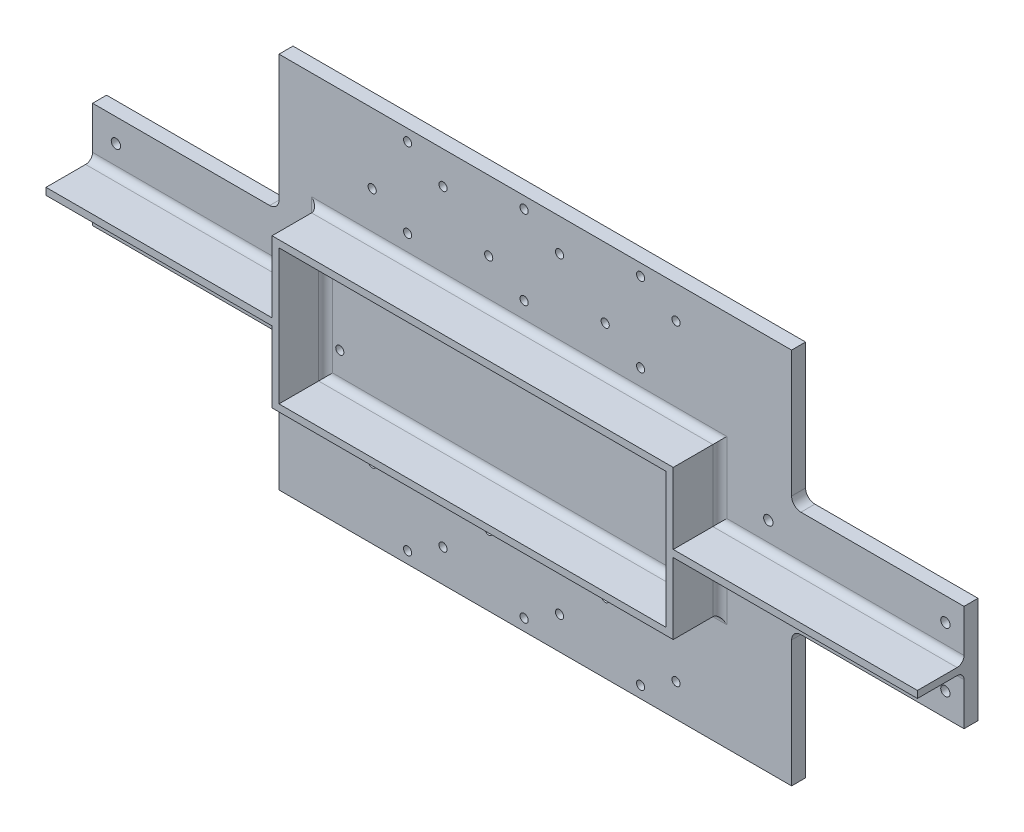
from build123d import *

# Parameters (mm, degrees)
BOSS_EXTRUDE1_DEPTH = 3
SKETCH3_W           = 166.2
SKETCH3_H           = 58
BOSS_EXTRUDE2_DEPTH = 20
SKETCH4_R           = 1.75
CUT_EXTRUDE1_DEPTH  = 205.768161588
FILLET1_R           = 4
FILLET2_R           = 3
CUT_EXTRUDE2_REACH  = 207.441
SKETCH5_R           = 2
SKETCH6_R           = 1.75
CUT_EXTRUDE3_DEPTH  = 205.768161588
SKETCH8_R           = 1.75
CUT_EXTRUDE5_DEPTH  = 205.768161588


with BuildPart() as part:
    # Sketch2 → Boss-Extrude1 (new, symmetric)
    with BuildSketch(Plane.XY):
        Polygon((-187, 22.75), (-187, -22.75), (-107, -22.75), (-107, -81), (113, -81), (113, -22.75), (187, -22.75), (187, 22.75), (113, 22.75), (113, 81), (-107, 81), (-107, 22.75), align=None)
    extrude(amount=BOSS_EXTRUDE1_DEPTH, both=True)

    # Sketch3 → Boss-Extrude2 (add)
    with BuildSketch(Plane.XY.offset(3)):
        Polygon((-187, -1.5), (-90, -1.5), (-90, -32), (82.2, -32), (82.2, -1.5), (187, -1.5), (187, 1.5), (82.2, 1.5), (82.2, 32), (-90, 32), (-90, 1.5), (-187, 1.5), align=None)
        with Locations((-3.9, 0)):
            Rectangle(SKETCH3_W, SKETCH3_H, mode=Mode.SUBTRACT)
    extrude(amount=BOSS_EXTRUDE2_DEPTH)

    # Sketch4 → Cut-Extrude1 (cut, through all)
    with BuildSketch(Plane.XY.offset(3)):
        with Locations((-36.6, -67)):
            Circle(SKETCH4_R)
        with Locations((-67, -51)):
            Circle(SKETCH4_R)
        with Locations((13.4, -67)):
            Circle(SKETCH4_R)
        with Locations((-17, -51)):
            Circle(SKETCH4_R)
        with Locations((63.4, -67)):
            Circle(SKETCH4_R)
        with Locations((33, -51)):
            Circle(SKETCH4_R)
        with Locations(Location((33, 51, 0), (0, 0, 180))):
            Circle(SKETCH4_R)
        with Locations(Location((63.4, 67, 0), (0, 0, 180))):
            Circle(SKETCH4_R)
        with Locations(Location((-17, 51, 0), (0, 0, 180))):
            Circle(SKETCH4_R)
        with Locations(Location((13.4, 67, 0), (0, 0, 180))):
            Circle(SKETCH4_R)
        with Locations(Location((-67, 51, 0), (0, 0, 180))):
            Circle(SKETCH4_R)
        with Locations(Location((-36.6, 67, 0), (0, 0, 180))):
            Circle(SKETCH4_R)
    extrude(amount=-CUT_EXTRUDE1_DEPTH, mode=Mode.SUBTRACT)

    # Fillet1
    fillet1_edges = [part.edges().sort_by_distance(p)[0] for p in [
        (-107, -22.75, 0),
        (-107, 22.75, 0),
        (113, 22.75, 0),
        (113, -22.75, 0),
    ]]
    fillet(fillet1_edges, radius=FILLET1_R)

    # Fillet2
    fillet2_edges = [part.edges().sort_by_distance(p)[0] for p in [
        (-87, 0, 3),
        (-3.9, -29, 3),
        (79.2, 0, 3),
        (-3.9, 29, 3),
        (-138.5, -1.5, 3),
        (-90, -16.75, 3),
        (-3.9, -32, 3),
        (82.2, -16.75, 3),
        (134.6, -1.5, 3),
        (134.6, 1.5, 3),
        (82.2, 16.75, 3),
        (-3.9, 32, 3),
        (-90, 16.75, 3),
        (-138.5, 1.5, 3),
    ]]
    fillet(fillet2_edges, radius=FILLET2_R)

    # Sketch5 → Cut-Extrude2 (cut, up to next)
    with BuildSketch(Plane(origin=(0, 0, -3), x_dir=(-1, 0, 0), z_dir=(0, 0, -1)), mode=Mode.PRIVATE) as cut_extrude2_sk1:
        with Locations((-103, -12.75)):
            Circle(SKETCH5_R)
    cut_extrude2_tool1 = extrude(cut_extrude2_sk1.sketch, amount=-CUT_EXTRUDE2_REACH, mode=Mode.PRIVATE) & part.part
    # Sketch5 → Cut-Extrude2 (cut, up to next)
    with BuildSketch(Plane(origin=(0, 0, -3), x_dir=(-1, 0, 0), z_dir=(0, 0, -1)), mode=Mode.PRIVATE) as cut_extrude2_sk2:
        with Locations((-103, 12.75)):
            Circle(SKETCH5_R)
    cut_extrude2_tool2 = extrude(cut_extrude2_sk2.sketch, amount=-CUT_EXTRUDE2_REACH, mode=Mode.PRIVATE) & part.part
    # Sketch5 → Cut-Extrude2 (cut, up to next)
    with BuildSketch(Plane(origin=(0, 0, -3), x_dir=(-1, 0, 0), z_dir=(0, 0, -1)), mode=Mode.PRIVATE) as cut_extrude2_sk3:
        with Locations((-179, 12.75)):
            Circle(SKETCH5_R)
    cut_extrude2_tool3 = extrude(cut_extrude2_sk3.sketch, amount=-CUT_EXTRUDE2_REACH, mode=Mode.PRIVATE) & part.part
    # Sketch5 → Cut-Extrude2 (cut, up to next)
    with BuildSketch(Plane(origin=(0, 0, -3), x_dir=(-1, 0, 0), z_dir=(0, 0, -1)), mode=Mode.PRIVATE) as cut_extrude2_sk4:
        with Locations((-179, -12.75)):
            Circle(SKETCH5_R)
    cut_extrude2_tool4 = extrude(cut_extrude2_sk4.sketch, amount=-CUT_EXTRUDE2_REACH, mode=Mode.PRIVATE) & part.part
    # Sketch5 → Cut-Extrude2 (cut, up to next)
    with BuildSketch(Plane(origin=(0, 0, -3), x_dir=(-1, 0, 0), z_dir=(0, 0, -1)), mode=Mode.PRIVATE) as cut_extrude2_sk5:
        with Locations((177, 12.75)):
            Circle(SKETCH5_R)
    cut_extrude2_tool5 = extrude(cut_extrude2_sk5.sketch, amount=-CUT_EXTRUDE2_REACH, mode=Mode.PRIVATE) & part.part
    # Sketch5 → Cut-Extrude2 (cut, up to next)
    with BuildSketch(Plane(origin=(0, 0, -3), x_dir=(-1, 0, 0), z_dir=(0, 0, -1)), mode=Mode.PRIVATE) as cut_extrude2_sk6:
        with Locations((177, -12.75)):
            Circle(SKETCH5_R)
    cut_extrude2_tool6 = extrude(cut_extrude2_sk6.sketch, amount=-CUT_EXTRUDE2_REACH, mode=Mode.PRIVATE) & part.part
    # Sketch5 → Cut-Extrude2 (cut, up to next)
    with BuildSketch(Plane(origin=(0, 0, -3), x_dir=(-1, 0, 0), z_dir=(0, 0, -1)), mode=Mode.PRIVATE) as cut_extrude2_sk7:
        with Locations((101, -12.75)):
            Circle(SKETCH5_R)
    cut_extrude2_tool7 = extrude(cut_extrude2_sk7.sketch, amount=-CUT_EXTRUDE2_REACH, mode=Mode.PRIVATE) & part.part
    # Sketch5 → Cut-Extrude2 (cut, up to next)
    with BuildSketch(Plane(origin=(0, 0, -3), x_dir=(-1, 0, 0), z_dir=(0, 0, -1)), mode=Mode.PRIVATE) as cut_extrude2_sk8:
        with Locations((101, 12.75)):
            Circle(SKETCH5_R)
    cut_extrude2_tool8 = extrude(cut_extrude2_sk8.sketch, amount=-CUT_EXTRUDE2_REACH, mode=Mode.PRIVATE) & part.part
    add(cut_extrude2_tool1.solids().sort_by_distance((103, -12.75, -3))[0], mode=Mode.SUBTRACT)
    add(cut_extrude2_tool2.solids().sort_by_distance((103, 12.75, -3))[0], mode=Mode.SUBTRACT)
    add(cut_extrude2_tool3.solids().sort_by_distance((179, 12.75, -3))[0], mode=Mode.SUBTRACT)
    add(cut_extrude2_tool4.solids().sort_by_distance((179, -12.75, -3))[0], mode=Mode.SUBTRACT)
    add(cut_extrude2_tool5.solids().sort_by_distance((-177, 12.75, -3))[0], mode=Mode.SUBTRACT)
    add(cut_extrude2_tool6.solids().sort_by_distance((-177, -12.75, -3))[0], mode=Mode.SUBTRACT)
    add(cut_extrude2_tool7.solids().sort_by_distance((-101, -12.75, -3))[0], mode=Mode.SUBTRACT)
    add(cut_extrude2_tool8.solids().sort_by_distance((-101, 12.75, -3))[0], mode=Mode.SUBTRACT)

    # Sketch6 → Cut-Extrude3 (cut, through all)
    with BuildSketch(Plane.XY.offset(3)):
        with Locations((-51.8, -76)):
            Circle(SKETCH6_R)
        with Locations(Location((-51.8, -42, 0), (0, 0, 180))):
            Circle(SKETCH6_R)
        with Locations((-1.8, -76)):
            Circle(SKETCH6_R)
        with Locations(Location((-1.8, -42, 0), (0, 0, 180))):
            Circle(SKETCH6_R)
        with Locations((48.2, -76)):
            Circle(SKETCH6_R)
        with Locations(Location((48.2, -42, 0), (0, 0, 180))):
            Circle(SKETCH6_R)
        with Locations((48.2, 42)):
            Circle(SKETCH6_R)
        with Locations(Location((48.2, 76, 0), (0, 0, 180))):
            Circle(SKETCH6_R)
        with Locations((-1.8, 42)):
            Circle(SKETCH6_R)
        with Locations(Location((-1.8, 76, 0), (0, 0, 180))):
            Circle(SKETCH6_R)
        with Locations((-51.8, 42)):
            Circle(SKETCH6_R)
        with Locations(Location((-51.8, 76, 0), (0, 0, 180))):
            Circle(SKETCH6_R)
    extrude(amount=-CUT_EXTRUDE3_DEPTH, mode=Mode.SUBTRACT)

    # Sketch8 → Cut-Extrude5 (cut, through all)
    with BuildSketch(Plane.XY.offset(3)):
        with Locations((-80.9, -16)):
            Circle(SKETCH8_R)
        with Locations(Location((-80.9, 16, 0), (0, 0, 180))):
            Circle(SKETCH8_R)
        with Locations((73.1, 16)):
            Circle(SKETCH8_R)
        with Locations(Location((73.1, -16, 0), (0, 0, 180))):
            Circle(SKETCH8_R)
    extrude(amount=-CUT_EXTRUDE5_DEPTH, mode=Mode.SUBTRACT)


solid = part.part
